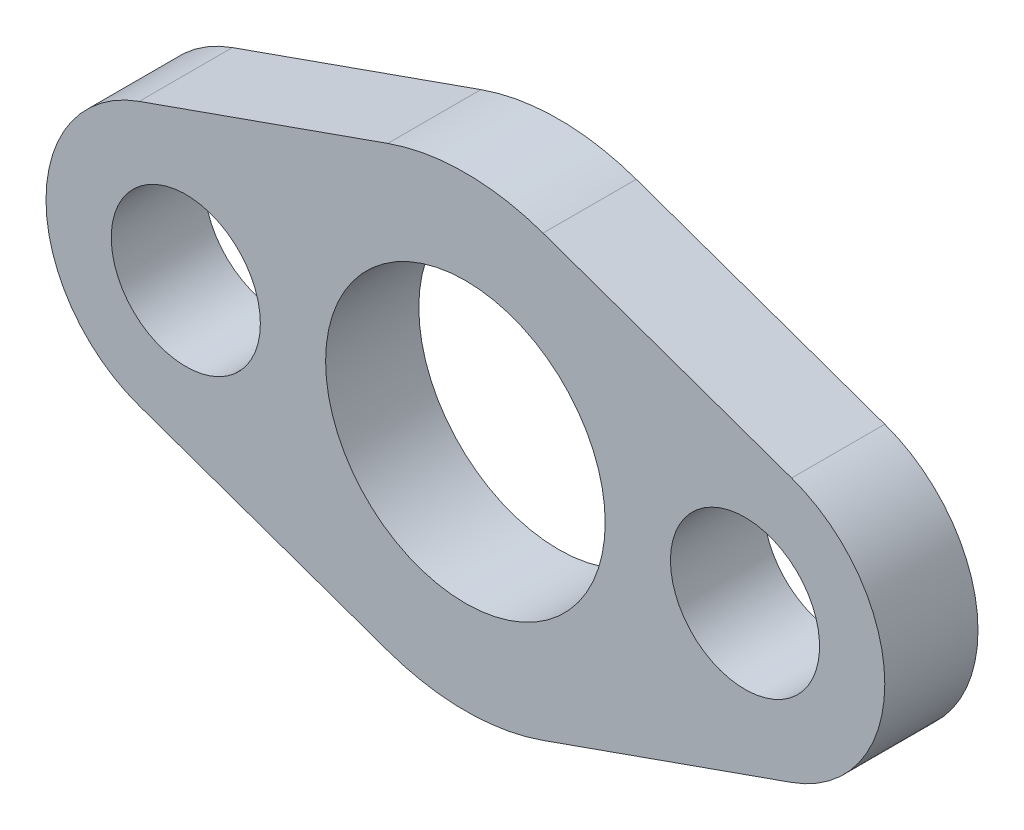
from build123d import *

# Parameters (mm, degrees)
SKETCH1_R           = 8
SKETCH1_R_2         = 15
BOSS_EXTRUDE1_DEPTH = 10


with BuildPart() as part:
    # Sketch1 → Boss-Extrude1 (new body)
    with BuildSketch(Plane.XY):
        with BuildLine():
            Line((-5, 14.142135624), (21.666666667, 23.57022604))
            ThreePointArc((21.666666667, 23.57022604), (30, 25), (38.333333333, 23.57022604))
            Line((38.333333333, 23.57022604), (65, 14.142135624))
            ThreePointArc((65, 14.142135624), (75, 0), (65, -14.142135624))
            Line((65, -14.142135624), (38.333333333, -23.57022604))
            ThreePointArc((38.333333333, -23.57022604), (30, -25), (21.666666667, -23.57022604))
            Line((21.666666667, -23.57022604), (-5, -14.142135624))
            ThreePointArc((-5, -14.142135624), (-15, 0), (-5, 14.142135624))
        make_face()
        Circle(SKETCH1_R, mode=Mode.SUBTRACT)
        with Locations((30, 0)):
            Circle(SKETCH1_R_2, mode=Mode.SUBTRACT)
        with Locations(Location((60, 0, 0), (0, 0, 180))):
            Circle(SKETCH1_R, mode=Mode.SUBTRACT)
    extrude(amount=BOSS_EXTRUDE1_DEPTH)


solid = part.part
